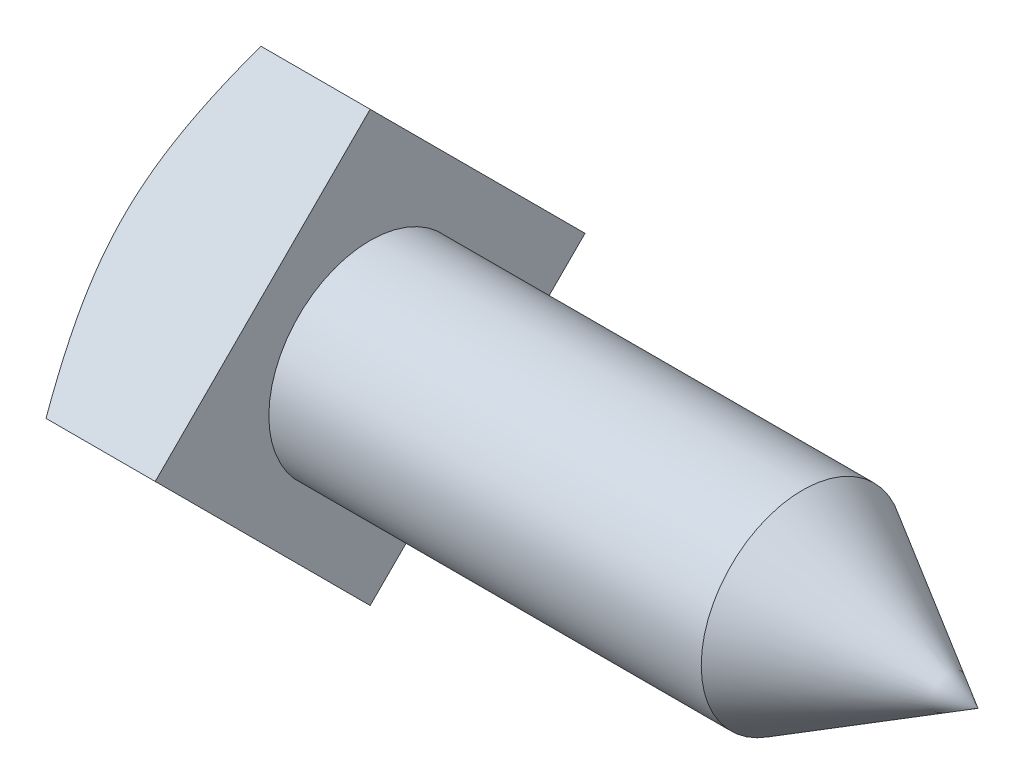
from build123d import *

# Parameters (mm, degrees)
SKETCH1_W      = 38.1
SKETCH1_H      = 38.1
BASEHEAD_DEPTH = 17.3736


with BuildPart() as part:
    # Sketch1 → BaseHead (new body)
    with BuildSketch(Plane(origin=(0, 0, 0), x_dir=(0, 0.7071067811865488, -0.7071067811865462), z_dir=(1, 0, 0))):
        Rectangle(SKETCH1_W, SKETCH1_H)
    extrude(amount=BASEHEAD_DEPTH)

    # Sketch2 → Body (revolve)
    with BuildSketch(Plane.XY):
        Polygon((17.3736, 0), (17.3736, 12.7), (71.576554744, 12.7), (93.5736, 0), align=None)
    revolve(axis=Axis((0, 0, 0), (1, 0, 0)))

    # Sketch3 → HeadChamfer (revolve, cut)
    with BuildSketch(Plane.XY):
        Polygon((0, 19.05), (-12.7, 19.05), (-12.7, 52.340768363), (15.523740234, 52.340768363), align=None)
    revolve(axis=Axis((0, 0, 0), (1, 0, 0)), mode=Mode.SUBTRACT)


solid = part.part
